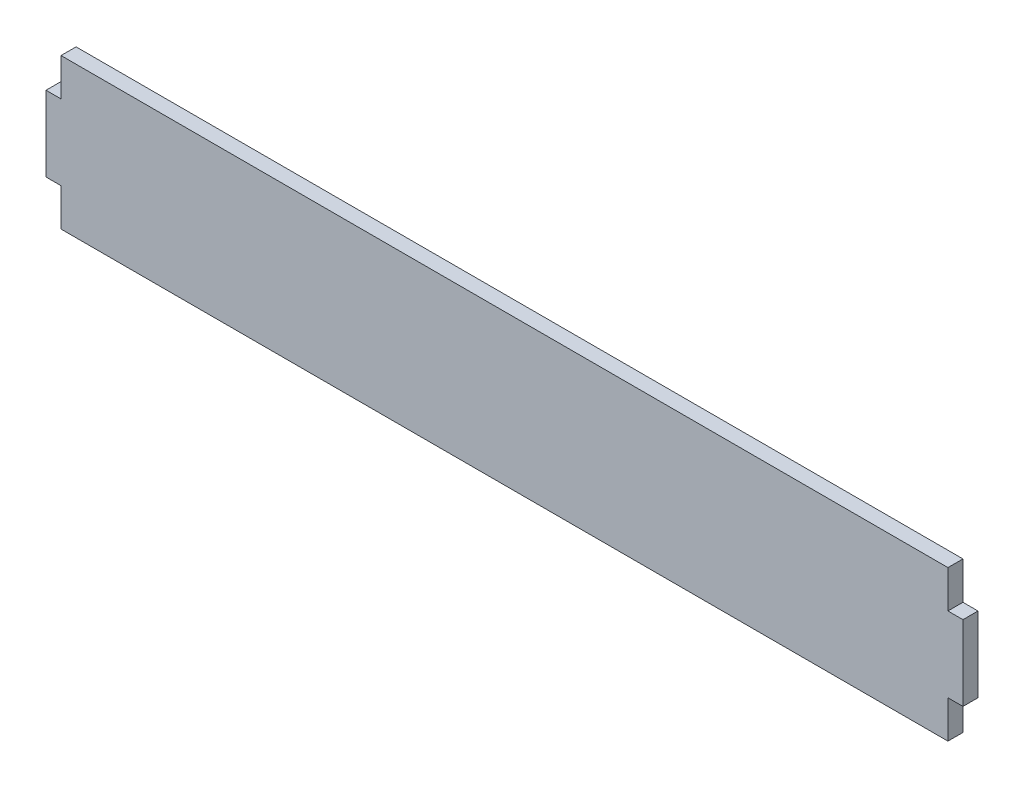
from build123d import *

# Parameters (mm, degrees)
SKETCH1_W           = 295
SKETCH1_H           = 50
SKETCH1_W_2         = 5
SKETCH1_H_2         = 25
BOSS_EXTRUDE1_DEPTH = 5


with BuildPart() as part:
    # Sketch1 → Boss-Extrude1 (new body)
    with BuildSketch(Plane.XY):
        with Locations((-147.5, -25)):
            Rectangle(SKETCH1_W, SKETCH1_H)
        with Locations((2.5, -25)):
            Rectangle(SKETCH1_W_2, SKETCH1_H_2)
        with Locations((-297.5, -25)):
            Rectangle(SKETCH1_W_2, SKETCH1_H_2)
    extrude(amount=BOSS_EXTRUDE1_DEPTH)


solid = part.part
